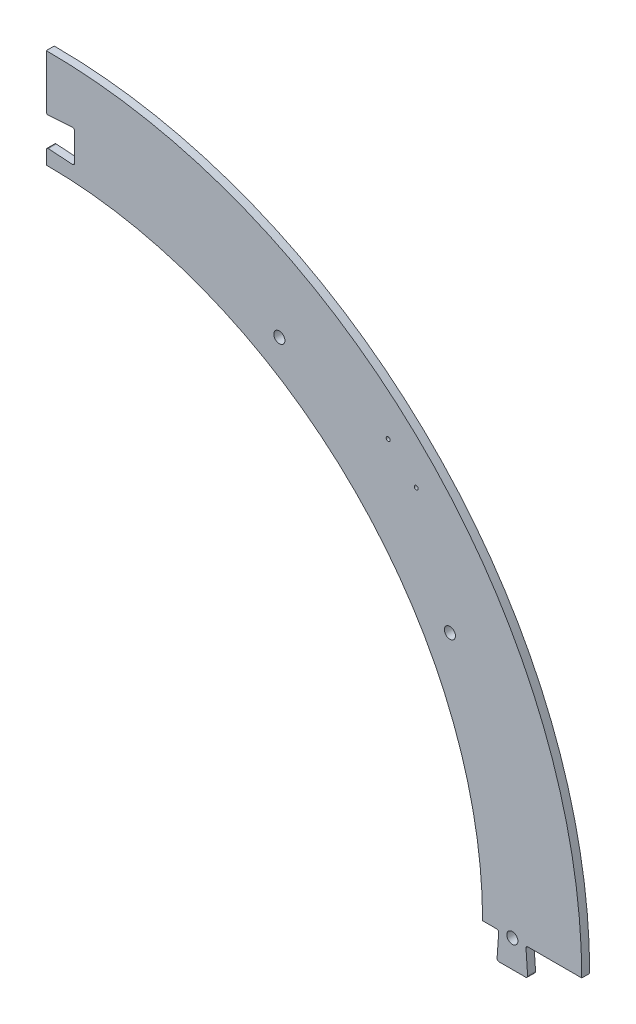
from build123d import *

# Parameters (mm, degrees)
BOSS_EXTRUDE1_DEPTH = 2
BOSS_EXTRUDE2_DEPTH = 2
BOSS_EXTRUDE3_DEPTH = 2
CUT_EXTRUDE1_REACH  = 192.961
FILLET1_R           = 0.5
CUT_EXTRUDE3_REACH  = 192.929
SKETCH4_R           = 1.4
CUT_EXTRUDE4_REACH  = 192.929
SKETCH9_R           = 0.5


with BuildPart() as part:
    # Sketch2 → Boss-Extrude1 (new body)
    with BuildSketch(Plane.XY):
        with BuildLine():
            Line((0, 135), (0, 110))
            ThreePointArc((0, 110), (77.781745931, 77.781745931), (110, 0))
            Line((110, 0), (135, 0))
            ThreePointArc((135, 0), (95.45941546, 95.45941546), (0, 135))
        make_face()
    extrude(amount=BOSS_EXTRUDE1_DEPTH)

    # Sketch3 → Boss-Extrude2 (add)
    with BuildSketch(Plane(origin=(0, 0, 0), x_dir=(-1, 0, 0), z_dir=(0, 0, -1))):
        with BuildLine():
            Line((0, 125.8), (0, 125))
            ThreePointArc((0, 125), (-88.388347648, 88.388347648), (-125, 0))
            Line((-125, 0), (-125.8, 0))
            ThreePointArc((-125.8, 0), (-88.954033073, 88.954033073), (0, 125.8))
        make_face()
    extrude(amount=BOSS_EXTRUDE2_DEPTH)

    # Sketch7 → Boss-Extrude3 (add)
    with BuildSketch(Plane.XY):
        Polygon((114.100254777, 0), (120.899745223, 0), (121.392602365, -6.9), (113.607397635, -6.9), align=None)
    extrude(amount=BOSS_EXTRUDE3_DEPTH)

    # Sketch8 → Cut-Extrude1 (cut, up to next)
    with BuildSketch(Plane.XY.offset(2), mode=Mode.PRIVATE) as cut_extrude1_sk1:
        Polygon((-0.007124705, 121.09974587), (-0.007124705, 113.90025413), (7.1, 113.392602365), (7.1, 121.607397635), align=None)
    cut_extrude1_tool1 = extrude(cut_extrude1_sk1.sketch, amount=-CUT_EXTRUDE1_REACH, mode=Mode.PRIVATE) & part.part
    add(cut_extrude1_tool1.solids().sort_by_distance((3.624459, 117.5, 2))[0], mode=Mode.SUBTRACT)

    # Fillet1
    fillet1_edges = [part.edges().sort_by_distance(p)[0] for p in [
        (120.899745223, 0, 1),
        (121.392602365, -6.9, 1),
        (113.607397635, -6.9, 1),
        (114.100254777, 0, 1),
        (0, 113.899745223, 1),
        (0, 121.100254777, 1),
        (7.1, 113.392602365, 1),
        (7.1, 121.607397635, 1),
    ]]
    fillet(fillet1_edges, radius=FILLET1_R)

    # Sketch4 → Cut-Extrude3 (cut, up to next)
    with BuildSketch(Plane.XY, mode=Mode.PRIVATE) as cut_extrude3_sk1:
        with Locations(Location((58.75, 101.757984945, 0), (0, 0, 180))):
            Circle(SKETCH4_R)
    cut_extrude3_tool1 = extrude(cut_extrude3_sk1.sketch, amount=CUT_EXTRUDE3_REACH, mode=Mode.PRIVATE) & part.part
    # Sketch4 → Cut-Extrude3 (cut, up to next)
    with BuildSketch(Plane.XY, mode=Mode.PRIVATE) as cut_extrude3_sk2:
        with Locations(Location((101.757984945, 58.75, 0), (0, 0, 180))):
            Circle(SKETCH4_R)
    cut_extrude3_tool2 = extrude(cut_extrude3_sk2.sketch, amount=CUT_EXTRUDE3_REACH, mode=Mode.PRIVATE) & part.part
    # Sketch4 → Cut-Extrude3 (cut, up to next)
    with BuildSketch(Plane.XY, mode=Mode.PRIVATE) as cut_extrude3_sk3:
        with Locations(Location((117.5, 0, 0), (0, 0, 180))):
            Circle(SKETCH4_R)
    cut_extrude3_tool3 = extrude(cut_extrude3_sk3.sketch, amount=CUT_EXTRUDE3_REACH, mode=Mode.PRIVATE) & part.part
    add(cut_extrude3_tool1.solids().sort_by_distance((58.75, 101.757985, 0))[0], mode=Mode.SUBTRACT)
    add(cut_extrude3_tool2.solids().sort_by_distance((101.757985, 58.75, 0))[0], mode=Mode.SUBTRACT)
    add(cut_extrude3_tool3.solids().sort_by_distance((117.5, 0, 0))[0], mode=Mode.SUBTRACT)

    # Sketch9 → Cut-Extrude4 (cut, up to next)
    with BuildSketch(Plane(origin=(0, 0, 0), x_dir=(-1, 0, 0), z_dir=(0, 0, -1)), mode=Mode.PRIVATE) as cut_extrude4_sk1:
        with Locations((-93.268471003, 86.197403191)):
            Circle(SKETCH9_R)
    cut_extrude4_tool1 = extrude(cut_extrude4_sk1.sketch, amount=-CUT_EXTRUDE4_REACH, mode=Mode.PRIVATE) & part.part
    # Sketch9 → Cut-Extrude4 (cut, up to next)
    with BuildSketch(Plane(origin=(0, 0, 0), x_dir=(-1, 0, 0), z_dir=(0, 0, -1)), mode=Mode.PRIVATE) as cut_extrude4_sk2:
        with Locations((-86.197403191, 93.268471003)):
            Circle(SKETCH9_R)
    cut_extrude4_tool2 = extrude(cut_extrude4_sk2.sketch, amount=-CUT_EXTRUDE4_REACH, mode=Mode.PRIVATE) & part.part
    add(cut_extrude4_tool1.solids().sort_by_distance((93.268471, 86.197403, 0))[0], mode=Mode.SUBTRACT)
    add(cut_extrude4_tool2.solids().sort_by_distance((86.197403, 93.268471, 0))[0], mode=Mode.SUBTRACT)


solid = part.part
